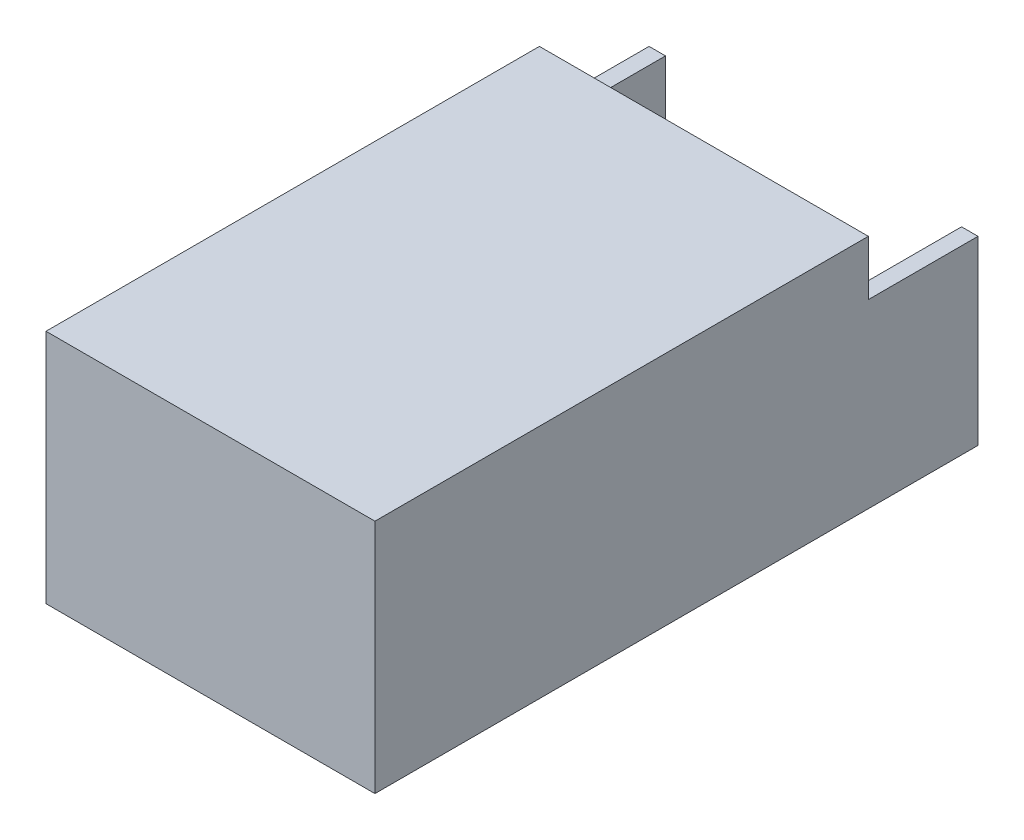
from build123d import *

# Parameters (mm, degrees)
IZIM1_W                     = 60
IZIM1_H                     = 43.037715622
IZIM1_W_2                   = 54
IZIM1_H_2                   = 37.037715622
Y_KSEKLIK_EKSTR_ZYON1_DEPTH = 110
IZIM2_W                     = 60
IZIM2_H                     = 20
KES_EKSTR_ZYON1_DEPTH       = 10
IZIM3_W                     = 60
IZIM3_H                     = 43.037715622
Y_KSEKLIK_EKSTR_ZYON2_DEPTH = 10


with BuildPart() as part:
    # Çizim1 → Yükseklik-Ekstrüzyon1 (new body)
    with BuildSketch(Plane.XY):
        with Locations((30, 21.518857811)):
            Rectangle(IZIM1_W, IZIM1_H)
        with Locations((30, 21.518857811)):
            Rectangle(IZIM1_W_2, IZIM1_H_2, mode=Mode.SUBTRACT)
    extrude(amount=Y_KSEKLIK_EKSTR_ZYON1_DEPTH)

    # Çizim2 → Kes-Ekstrüzyon1 (cut)
    with BuildSketch(Plane(origin=(0, 43.037715622, 0), x_dir=(1, 0, 0), z_dir=(0, 1, 0))):
        with Locations((30, -10)):
            Rectangle(IZIM2_W, IZIM2_H)
    extrude(amount=-KES_EKSTR_ZYON1_DEPTH, mode=Mode.SUBTRACT)

    # Çizim3 → Yükseklik-Ekstrüzyon2 (add)
    with BuildSketch(Plane.XY.offset(110)):
        with Locations((30, 21.518857811)):
            Rectangle(IZIM3_W, IZIM3_H)
    extrude(amount=-Y_KSEKLIK_EKSTR_ZYON2_DEPTH)


solid = part.part
